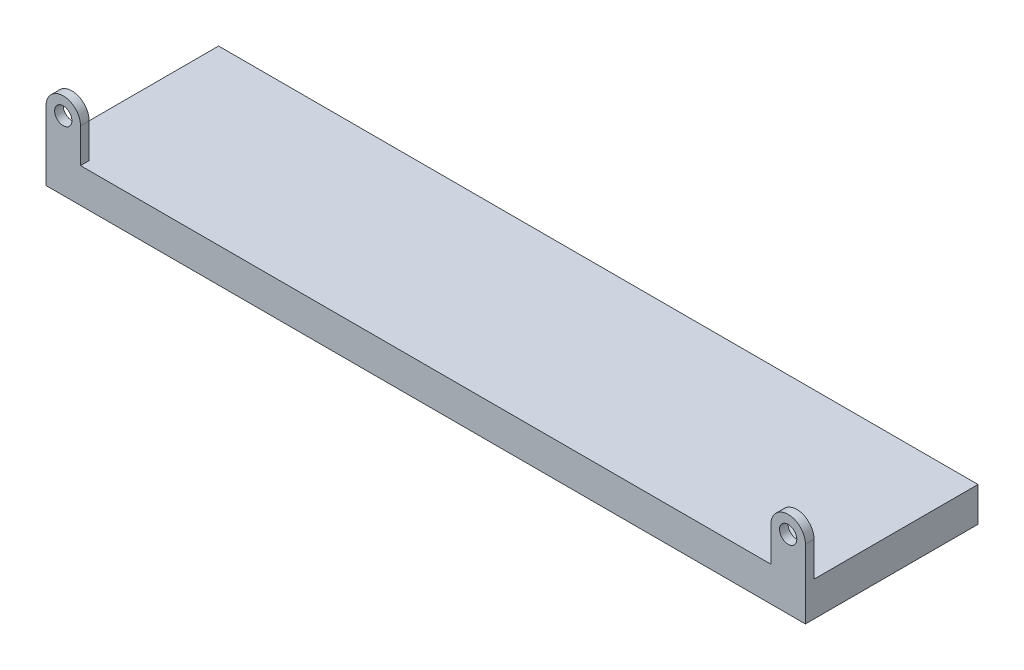
from build123d import *

# Parameters (mm, degrees)
SKETCH1_R           = 63.5
SKETCH1_W           = 127
SKETCH1_H           = 127
BOSS_EXTRUDE1_DEPTH = 31.75
SKETCH2_W           = 2794
SKETCH2_H           = 127
BOSS_EXTRUDE2_DEPTH = 635
SKETCH3_R           = 31.75
CUT_EXTRUDE1_DEPTH  = 2815.848352931


with BuildPart() as part:
    # Sketch1 → Boss-Extrude1 (new body)
    with BuildSketch(Plane.XY):
        Circle(SKETCH1_R)
        with Locations((2667, 0)):
            Circle(SKETCH1_R)
        with Locations((0, -63.5)):
            Rectangle(SKETCH1_W, SKETCH1_H)
        with Locations((2667, -63.5)):
            Rectangle(SKETCH1_W, SKETCH1_H)
    extrude(amount=-BOSS_EXTRUDE1_DEPTH)

    # Sketch2 → Boss-Extrude2 (add)
    with BuildSketch(Plane.XY):
        with Locations((1333.5, -190.5)):
            Rectangle(SKETCH2_W, SKETCH2_H)
    extrude(amount=-BOSS_EXTRUDE2_DEPTH)

    # Sketch3 → Cut-Extrude1 (cut, through all)
    with BuildSketch(Plane.XY):
        Circle(SKETCH3_R)
        with Locations((2667, 0)):
            Circle(SKETCH3_R)
    extrude(amount=-CUT_EXTRUDE1_DEPTH, mode=Mode.SUBTRACT)


solid = part.part
